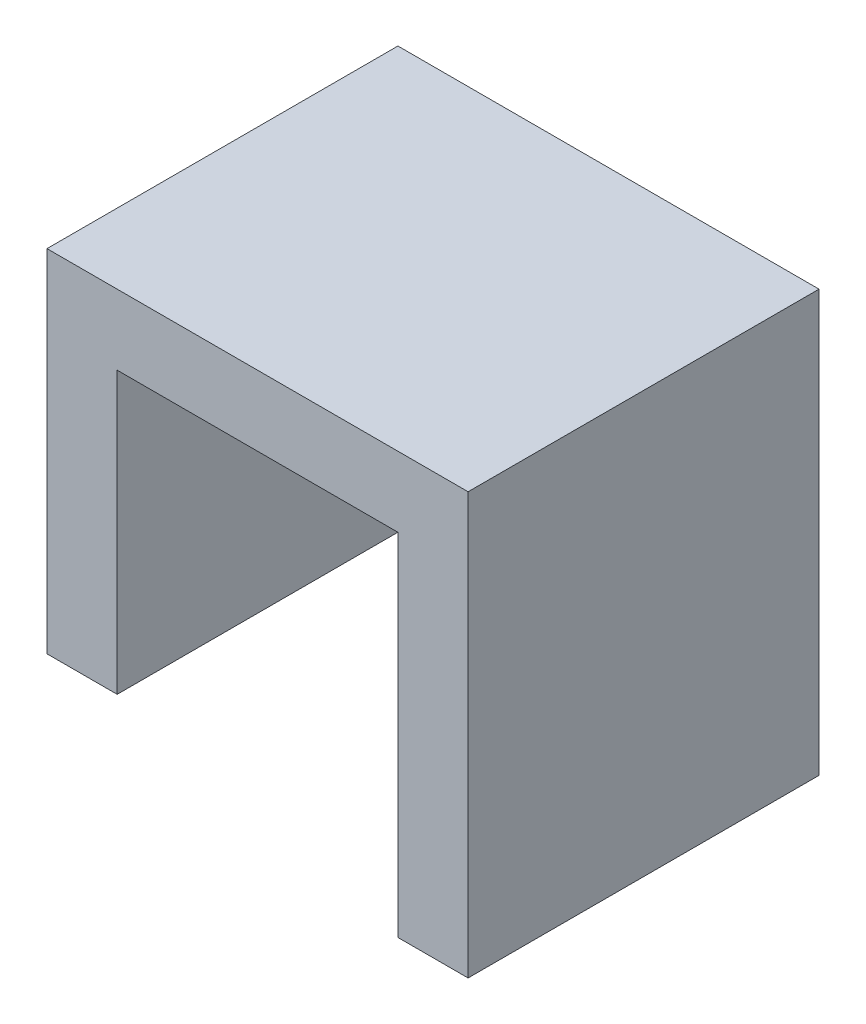
from build123d import *

# Parameters (mm, degrees)
SKETCH1_W           = 2
SKETCH1_H           = 10
BOSS_EXTRUDE1_DEPTH = 10
SKETCH2_W           = 10
SKETCH2_H           = 2
BOSS_EXTRUDE2_DEPTH = 10
SKETCH3_W           = 2
SKETCH3_H           = 10
BOSS_EXTRUDE3_DEPTH = 10


with BuildPart() as part:
    # Sketch1 → Boss-Extrude1 (new body)
    with BuildSketch(Plane(origin=(0, 0, 0), x_dir=(1, 0, 0), z_dir=(0, 1, 0))):
        with Locations((-2.126760563, -1.464788732)):
            Rectangle(SKETCH1_W, SKETCH1_H)
    extrude(amount=BOSS_EXTRUDE1_DEPTH)

    # Sketch2 → Boss-Extrude2 (add)
    with BuildSketch(Plane(origin=(-1.126760563, 0, 0), x_dir=(0, 0, -1), z_dir=(1, 0, 0))):
        with Locations((-1.464788732, 9)):
            Rectangle(SKETCH2_W, SKETCH2_H)
    extrude(amount=BOSS_EXTRUDE2_DEPTH)

    # Sketch3 → Boss-Extrude3 (add)
    with BuildSketch(Plane.XZ.offset(-8)):
        with Locations((7.873239437, 1.464788732)):
            Rectangle(SKETCH3_W, SKETCH3_H)
    extrude(amount=BOSS_EXTRUDE3_DEPTH)


solid = part.part
